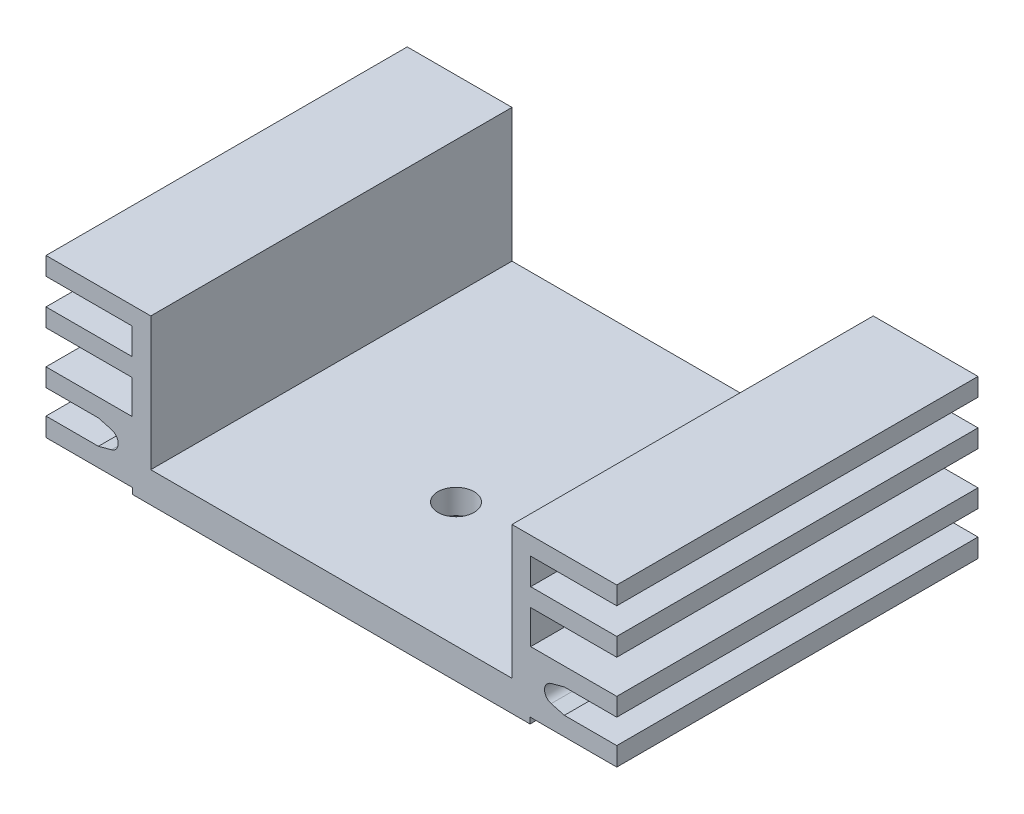
from build123d import *

# Parameters (mm, degrees)
BOSS_EXTRUDE1_DEPTH = 15
SKETCH2_R           = 1.5
CUT_EXTRUDE1_DEPTH  = 32.171300903
CHAMFER1_SIZE       = 0.5


with BuildPart() as part:
    # Sketch1 → Boss-Extrude1 (new, symmetric)
    with BuildSketch(Plane.XY):
        with BuildLine():
            Line((-15, 13.1), (-15, 2.04))
            Line((-15, 2.04), (15, 2.04))
            Line((15, 2.04), (15, 13.1))
            Line((15, 13.1), (23.7, 13.1))
            Line((23.7, 13.1), (23.7, 11.6))
            Line((23.7, 11.6), (16.55, 11.6))
            Line((16.55, 11.6), (16.55, 9.4))
            Line((16.55, 9.4), (23.7, 9.4))
            Line((23.7, 9.4), (23.7, 7.9))
            Line((23.7, 7.9), (16.55, 7.9))
            Line((16.55, 7.9), (16.55, 5.09))
            Line((16.55, 5.09), (23.7, 5.09))
            Line((23.7, 5.09), (23.7, 3.59))
            Line((23.7, 3.59), (19.35, 3.59))
            Line((19.35, 3.59), (18.254412307, 3.294047964))
            ThreePointArc((18.254412307, 3.294047964), (17.7, 2.57), (18.254412307, 1.845952036))
            Line((18.254412307, 1.845952036), (19.35, 1.55))
            Line((19.35, 1.55), (23.7, 1.55))
            Line((23.7, 1.55), (23.7, 0))
            Line((23.7, 0), (16.5, 0))
            Line((16.5, 0), (16.5, -0.5))
            Line((16.5, -0.5), (-16.5, -0.5))
            Line((-16.5, -0.5), (-16.5, 0))
            Line((-16.5, 0), (-23.7, 0))
            Line((-23.7, 0), (-23.7, 1.55))
            Line((-23.7, 1.55), (-19.35, 1.55))
            Line((-19.35, 1.55), (-18.254412307, 1.845952036))
            ThreePointArc((-18.254412307, 1.845952036), (-17.7, 2.57), (-18.254412307, 3.294047964))
            Line((-18.254412307, 3.294047964), (-19.35, 3.59))
            Line((-19.35, 3.59), (-23.7, 3.59))
            Line((-23.7, 3.59), (-23.7, 5.09))
            Line((-23.7, 5.09), (-16.55, 5.09))
            Line((-16.55, 5.09), (-16.55, 7.9))
            Line((-16.55, 7.9), (-23.7, 7.9))
            Line((-23.7, 7.9), (-23.7, 9.4))
            Line((-23.7, 9.4), (-16.55, 9.4))
            Line((-16.55, 9.4), (-16.55, 11.6))
            Line((-16.55, 11.6), (-23.7, 11.6))
            Line((-23.7, 11.6), (-23.7, 13.1))
            Line((-23.7, 13.1), (-15, 13.1))
        make_face()
    extrude(amount=BOSS_EXTRUDE1_DEPTH, both=True)

    # Sketch2 → Cut-Extrude1 (cut, through all)
    with BuildSketch(Plane.XZ.offset(0.5)):
        with Locations(Location((0, 4.65, 0), (0, 0, 270))):
            Circle(SKETCH2_R)
    extrude(amount=-CUT_EXTRUDE1_DEPTH, mode=Mode.SUBTRACT)

    # Chamfer1
    chamfer1_edges = [part.edges().sort_by_distance(p)[0] for p in [
        (0, -0.5, 6.15),
    ]]
    chamfer(chamfer1_edges, length=CHAMFER1_SIZE)


solid = part.part
